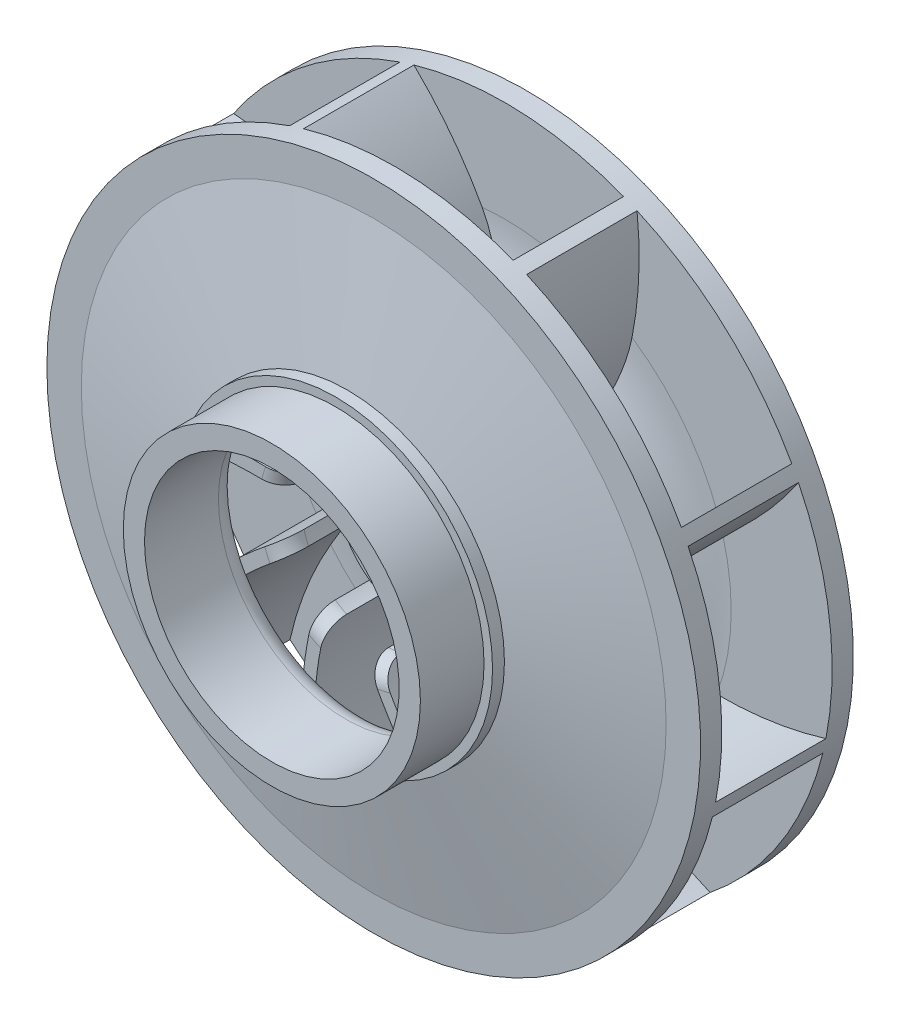
from build123d import *

# Parameters (mm, degrees)
CUT_EXTRUDE1_REACH              = 129.904
SKETCH2_W                       = 6
SKETCH2_H                       = 6.80099926
BOSS_EXTRUDE1_REACH             = 120.604
BOSS_EXTRUDE1_DIRECTION_2_DEPTH = 12
FILLET1_R                       = 5
CIRPATTERN1_COUNT               = 9
FILLET1_OF_CIRPATTERN1_R        = 5
CHAMFER1_SIZE                   = 1


with BuildPart() as part:
    # Sketch1 → Revolve1 (revolve)
    with BuildSketch(Plane(origin=(0, 0, 0), x_dir=(0, 0, -1), z_dir=(1, 0, 0))):
        with BuildLine():
            Line((-14.369879861, 42.5), (-14.369879861, 37.5))
            Line((-14.369879861, 37.5), (-29.369879861, 37.5))
            Line((-29.369879861, 37.5), (-29.369879861, 36))
            Line((-29.369879861, 36), (-34.369879861, 36))
            Line((-34.369879861, 36), (-34.369879861, 22))
            Line((-34.369879861, 22), (-27.277090652, 22))
            Line((-27.277090652, 22), (-27.277090652, 9))
            Line((-27.277090652, 9), (-61.369879861, 9))
            Line((-61.369879861, 9), (-61.369879861, 17.5))
            ThreePointArc((-61.369879861, 17.5), (-45.311107129, 32.244965236), (-39.369879861, 53.221142199))
            Line((-39.369879861, 53.221142199), (-39.369879861, 77))
            Line((-39.369879861, 77), (-34.369879861, 77))
            Line((-34.369879861, 77), (-34.369879861, 42.5))
            Line((-34.369879861, 42.5), (-14.369879861, 42.5))
        make_face()
        with BuildLine():
            Line((-65.369879861, 77), (-70.369879861, 77))
            Line((-70.369879861, 77), (-70.369879861, 68.896234899))
            Line((-70.369879861, 68.896234899), (-76.569879861, 37))
            Line((-76.569879861, 37), (-79.369879861, 37))
            Line((-79.369879861, 37), (-79.369879861, 35))
            Line((-79.369879861, 35), (-94.369879861, 35))
            Line((-94.369879861, 35), (-94.369879861, 30))
            Line((-94.369879861, 30), (-76.958640479, 30))
            ThreePointArc((-76.958640479, 30), (-73.778249378, 31.141877083), (-72.050504562, 34.045955023))
            Line((-72.050504562, 34.045955023), (-65.369879861, 68.414789658))
            Line((-65.369879861, 68.414789658), (-65.369879861, 77))
        make_face()
    revolve(axis=Axis((0, 0, 0), (0, 0, 1)))

    # Sketch2 → Cut-Extrude1 (cut, up to next)
    with BuildSketch(Plane(origin=(0, 0, 27.277090652), x_dir=(-1, 0, 0), z_dir=(0, 0, -1)), mode=Mode.PRIVATE) as cut_extrude1_sk1:
        with Locations((0, 8.39950037)):
            Rectangle(SKETCH2_W, SKETCH2_H)
    cut_extrude1_tool1 = extrude(cut_extrude1_sk1.sketch, amount=-CUT_EXTRUDE1_REACH, mode=Mode.PRIVATE) & part.part
    add(cut_extrude1_tool1.solids().sort_by_distance((0, 8.3995, 27.277091))[0], mode=Mode.SUBTRACT)

    # Sketch3 → Boss-Extrude1 (add, up to next)
    with BuildSketch(Plane(origin=(0, 0, 61.369879861), x_dir=(-1, 0, 0), z_dir=(0, 0, -1)), mode=Mode.PRIVATE) as boss_extrude1_sk1:
        with BuildLine():
            ThreePointArc((10.580785698, 15.781222197), (9.24733597, 16.597794355), (7.851258512, 17.301957686))
            ThreePointArc((7.851258512, 17.301957686), (33.624870946, 35.130206454), (64.011725077, 42.796016786))
            ThreePointArc((64.011725077, 42.796016786), (64.950250141, 41.357768395), (65.85646563, 39.898946536))
            ThreePointArc((65.85646563, 39.898946536), (36.007766894, 32.907176104), (10.580785698, 15.781222197))
        make_face()
    boss_extrude1_tool1 = extrude(boss_extrude1_sk1.sketch, amount=BOSS_EXTRUDE1_REACH, mode=Mode.PRIVATE) - part.part
    boss_extrude1 = boss_extrude1_tool1.solids().sort_by_distance((-64.410509, 41.014083, 61.36988))[0]
    add(boss_extrude1)

    # Sketch3 → Boss-Extrude1 direction 2 (add)
    with BuildSketch(Plane(origin=(0, 0, 61.369879861), x_dir=(-1, 0, 0), z_dir=(0, 0, -1))):
        with BuildLine():
            ThreePointArc((10.580785698, 15.781222197), (9.24733597, 16.597794355), (7.851258512, 17.301957686))
            ThreePointArc((7.851258512, 17.301957686), (33.624870946, 35.130206454), (64.011725077, 42.796016786))
            ThreePointArc((64.011725077, 42.796016786), (64.950250141, 41.357768395), (65.85646563, 39.898946536))
            ThreePointArc((65.85646563, 39.898946536), (36.007766894, 32.907176104), (10.580785698, 15.781222197))
        make_face()
    boss_extrude1_direction_2 = extrude(amount=-BOSS_EXTRUDE1_DIRECTION_2_DEPTH)

    # Fillet1
    fillet1_edges = [part.edges().sort_by_distance(p)[0] for p in [
        (-9.24733597, 16.597794355, 73.369879861),
    ]]
    fillet(fillet1_edges, radius=FILLET1_R)

    # CirPattern1: Boss-Extrude1, Boss-Extrude1 direction 2 ×9 about axis
    cirpattern1_axis = Axis((0, 0, 0), (0, 0, -1))
    add([boss_extrude1.rotate(cirpattern1_axis, i * 360 / CIRPATTERN1_COUNT) for i in range(1, CIRPATTERN1_COUNT)])
    add([boss_extrude1_direction_2.rotate(cirpattern1_axis, i * 360 / CIRPATTERN1_COUNT) for i in range(1, CIRPATTERN1_COUNT)])

    # Fillet1 of CirPattern1
    fillet1_of_cirpattern1_edges = [part.edges().sort_by_distance(p)[0] for p in [
        (3.584986226, 18.658721118, 73.369879861),
        (14.739853524, 11.989024901, 73.369879861),
        (18.997779543, -0.29046931, 73.369879861),
        (14.366433377, -12.434049703, 73.369879861),
        (3.012873369, -18.759600051, 73.369879861),
        (-9.750443573, -16.307325045, 73.369879861),
        (-17.951419603, -6.224671415, 73.369879861),
        (-17.752726893, 6.770575149, 73.369879861),
    ]]
    fillet(fillet1_of_cirpattern1_edges, radius=FILLET1_OF_CIRPATTERN1_R)

    # Sketch5 → Cut-Revolve2 (revolve, cut)
    with BuildSketch(Plane(origin=(0, 0, 0), x_dir=(0, 0, -1), z_dir=(1, 0, 0))):
        Polygon((-70.369879861, 77), (-70.369879861, 68.896234899), (-76.569879861, 37), (-76.569879861, 77), align=None)
    revolve(axis=Axis((0, 0, 0), (0, 0, 1)), mode=Mode.SUBTRACT)

    # Chamfer1
    chamfer1_edges = [part.edges().sort_by_distance(p)[0] for p in [
        (0, -42.5, 14.369879861),
    ]]
    chamfer(chamfer1_edges, length=CHAMFER1_SIZE)


solid = part.part
